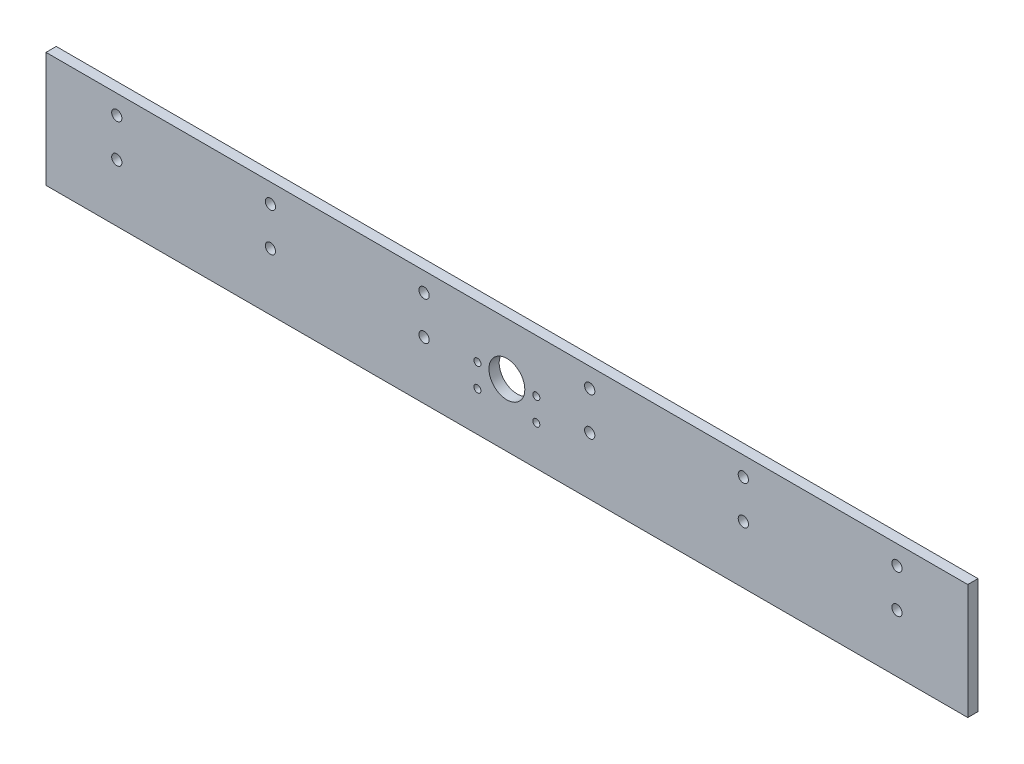
from build123d import *

# Parameters (mm, degrees)
ESQUISSE1_W        = 680
ESQUISSE1_H        = 90
ESQUISSE1_R        = 2.75
ESQUISSE1_R_2      = 14
ESQUISSE1_R_3      = 4
BOSS_EXTRU_1_DEPTH = 8
ESQUISSE2_W        = 8
ESQUISSE2_H        = 90
BOSS_EXTRU_2_DEPTH = 20
ESQUISSE3_W        = 8
ESQUISSE3_H        = 90
BOSS_EXTRU_3_DEPTH = 20


with BuildPart() as part:
    # Esquisse1 → Boss.-Extru.1 (new body)
    with BuildSketch(Plane.XY):
        with Locations((340, 45)):
            Rectangle(ESQUISSE1_W, ESQUISSE1_H)
        with Locations((317, 48.92)):
            Circle(ESQUISSE1_R, mode=Mode.SUBTRACT)
        with Locations((363, 48.92)):
            Circle(ESQUISSE1_R, mode=Mode.SUBTRACT)
        with Locations((363, 30.92)):
            Circle(ESQUISSE1_R, mode=Mode.SUBTRACT)
        with Locations((317, 30.92)):
            Circle(ESQUISSE1_R, mode=Mode.SUBTRACT)
        with Locations((340, 48.92)):
            Circle(ESQUISSE1_R_2, mode=Mode.SUBTRACT)
        with Locations((35.3, 75)):
            Circle(ESQUISSE1_R_3, mode=Mode.SUBTRACT)
        with Locations((35.3, 45)):
            Circle(ESQUISSE1_R_3, mode=Mode.SUBTRACT)
        with Locations(Location((644.7, 45, 0), (0, 0, 180))):
            Circle(ESQUISSE1_R_3, mode=Mode.SUBTRACT)
        with Locations(Location((644.7, 75, 0), (0, 0, 180))):
            Circle(ESQUISSE1_R_3, mode=Mode.SUBTRACT)
        with Locations((155.3, 75)):
            Circle(ESQUISSE1_R_3, mode=Mode.SUBTRACT)
        with Locations((155.3, 45)):
            Circle(ESQUISSE1_R_3, mode=Mode.SUBTRACT)
        with Locations((275.3, 75)):
            Circle(ESQUISSE1_R_3, mode=Mode.SUBTRACT)
        with Locations((275.3, 45)):
            Circle(ESQUISSE1_R_3, mode=Mode.SUBTRACT)
        with Locations(Location((404.7, 45, 0), (0, 0, 180))):
            Circle(ESQUISSE1_R_3, mode=Mode.SUBTRACT)
        with Locations(Location((404.7, 75, 0), (0, 0, 180))):
            Circle(ESQUISSE1_R_3, mode=Mode.SUBTRACT)
        with Locations(Location((524.7, 45, 0), (0, 0, 180))):
            Circle(ESQUISSE1_R_3, mode=Mode.SUBTRACT)
        with Locations(Location((524.7, 75, 0), (0, 0, 180))):
            Circle(ESQUISSE1_R_3, mode=Mode.SUBTRACT)
    extrude(amount=BOSS_EXTRU_1_DEPTH)

    # Esquisse2 → Boss.-Extru.2 (add)
    with BuildSketch(Plane.ZY):
        with Locations((4, 45)):
            Rectangle(ESQUISSE2_W, ESQUISSE2_H)
    extrude(amount=BOSS_EXTRU_2_DEPTH)

    # Esquisse3 → Boss.-Extru.3 (add)
    with BuildSketch(Plane(origin=(680, 0, 0), x_dir=(0, 0, -1), z_dir=(1, 0, 0))):
        with Locations((-4, 45)):
            Rectangle(ESQUISSE3_W, ESQUISSE3_H)
    extrude(amount=BOSS_EXTRU_3_DEPTH)


solid = part.part
